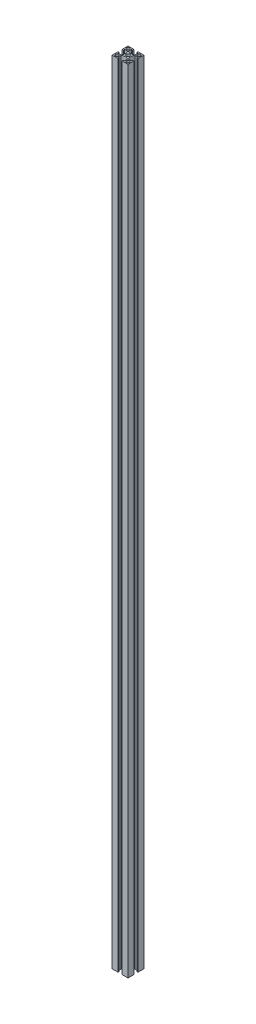
from build123d import *

# Parameters (mm, degrees)
SKETCH_2_W               = 20
SKETCH_2_H               = 20
EXTRUDE_20201000_DEPTH   = 1000
CUT_EXTRUDE_1005_DEPTH   = 1001.099995
PATTERN_CIRCULAR_1_COUNT = 4
SKETCH_4_R               = 2.15
CUT_EXTRUDE_4_DEPTH      = 1000


with BuildPart() as part:
    # 스케치2 → 20201000 (new body)
    with BuildSketch(Plane(origin=(0, 0, 0), x_dir=(1, 0, 0), z_dir=(0, 1, 0))):
        Rectangle(SKETCH_2_W, SKETCH_2_H)
    extrude(amount=EXTRUDE_20201000_DEPTH)

    # 스케치1 → Cut-Extrude 1005 (cut, symmetric)
    with BuildSketch(Plane(origin=(0, 0, 0), x_dir=(1, 0, 0), z_dir=(0, 1, 0))):
        with BuildLine():
            Line((4.15, 7), (-4.15, 7))
            Line((-4.15, 7), (-4.15, 4.740009506))
            ThreePointArc((-4.15, 4.740009506), (0, 3.3), (4.15, 4.740009506))
            Line((4.15, 4.740009506), (4.15, 7))
        make_face()
        Polygon((2.65, 10), (-2.65, 10), (-2.65, 8.5), (-4.15, 8.5), (-4.15, 7), (4.15, 7), (4.15, 8.5), (2.65, 8.5), align=None)
    cut_extrude_1005 = extrude(amount=CUT_EXTRUDE_1005_DEPTH, both=True, mode=Mode.SUBTRACT)

    # 원형 패턴1: Cut-Extrude 1005 ×4 about axis
    pattern_circular_1_axis = Axis((0, 0, 0), (0, 1, 0))
    for i in range(1, PATTERN_CIRCULAR_1_COUNT):
        add(cut_extrude_1005.rotate(pattern_circular_1_axis, i * 360 / PATTERN_CIRCULAR_1_COUNT), mode=Mode.SUBTRACT)

    # 스케치4 → 컷-돌출4 (cut)
    with BuildSketch(Plane.XZ):
        with BuildLine():
            ThreePointArc((9, 7), (7, 9), (5, 7))
            Line((5, 7), (7, 7))
            Line((7, 7), (7, 5))
            ThreePointArc((7, 5), (8.414213562, 5.585786438), (9, 7))
        make_face()
        with BuildLine():
            Line((7, 7), (5, 7))
            ThreePointArc((5, 7), (5.585786438, 5.585786438), (7, 5))
            Line((7, 5), (7, 7))
        make_face()
        with Locations(Location((0, 0, 0), (0, 0, 270))):
            Circle(SKETCH_4_R)
        with BuildLine():
            ThreePointArc((9, -7), (8.414213562, -5.585786438), (7, -5))
            Line((7, -5), (7, -7))
            Line((7, -7), (5, -7))
            ThreePointArc((5, -7), (7, -9), (9, -7))
        make_face()
        with BuildLine():
            Line((7, -7), (7, -5))
            ThreePointArc((7, -5), (5.585786438, -5.585786438), (5, -7))
            Line((5, -7), (7, -7))
        make_face()
        with BuildLine():
            ThreePointArc((-5, -7), (-5.585786438, -5.585786438), (-7, -5))
            Line((-7, -5), (-7, -7))
            Line((-7, -7), (-5, -7))
        make_face()
        with BuildLine():
            Line((-7, -7), (-7, -5))
            ThreePointArc((-7, -5), (-8.414213562, -8.414213562), (-5, -7))
            Line((-5, -7), (-7, -7))
        make_face()
        with BuildLine():
            Line((-7, 5), (-7, 7))
            Line((-7, 7), (-5, 7))
            ThreePointArc((-5, 7), (-8.414213562, 8.414213562), (-7, 5))
        make_face()
        with BuildLine():
            Line((-5, 7), (-7, 7))
            Line((-7, 7), (-7, 5))
            ThreePointArc((-7, 5), (-5.585786438, 5.585786438), (-5, 7))
        make_face()
    extrude(amount=-CUT_EXTRUDE_4_DEPTH, mode=Mode.SUBTRACT)


solid = part.part
